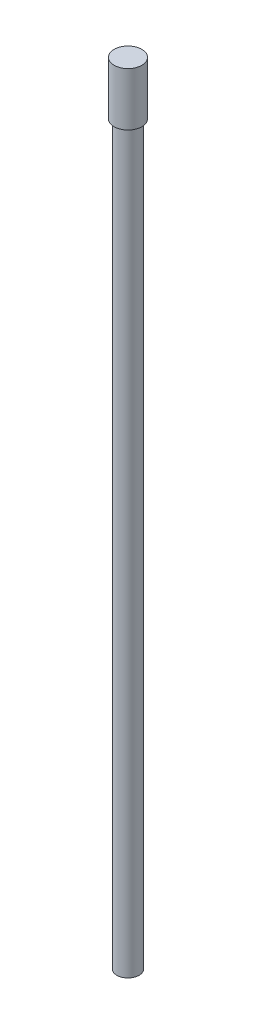
from build123d import *

# Parameters (mm, degrees)
SKETCH1_R           = 5.1
BOSS_EXTRUDE1_DEPTH = 362.06
SKETCH2_R           = 6.35
BOSS_EXTRUDE2_DEPTH = 24.4


with BuildPart() as part:
    # Sketch1 → Boss-Extrude1 (new body)
    with BuildSketch(Plane(origin=(0, 0, 0), x_dir=(1, 0, 0), z_dir=(0, 1, 0))):
        Circle(SKETCH1_R)
    extrude(amount=BOSS_EXTRUDE1_DEPTH)

    # Sketch2 → Boss-Extrude2 (add)
    with BuildSketch(Plane(origin=(0, 362.06, 0), x_dir=(1, 0, 0), z_dir=(0, 1, 0))):
        Circle(SKETCH2_R)
    extrude(amount=-BOSS_EXTRUDE2_DEPTH)


solid = part.part
